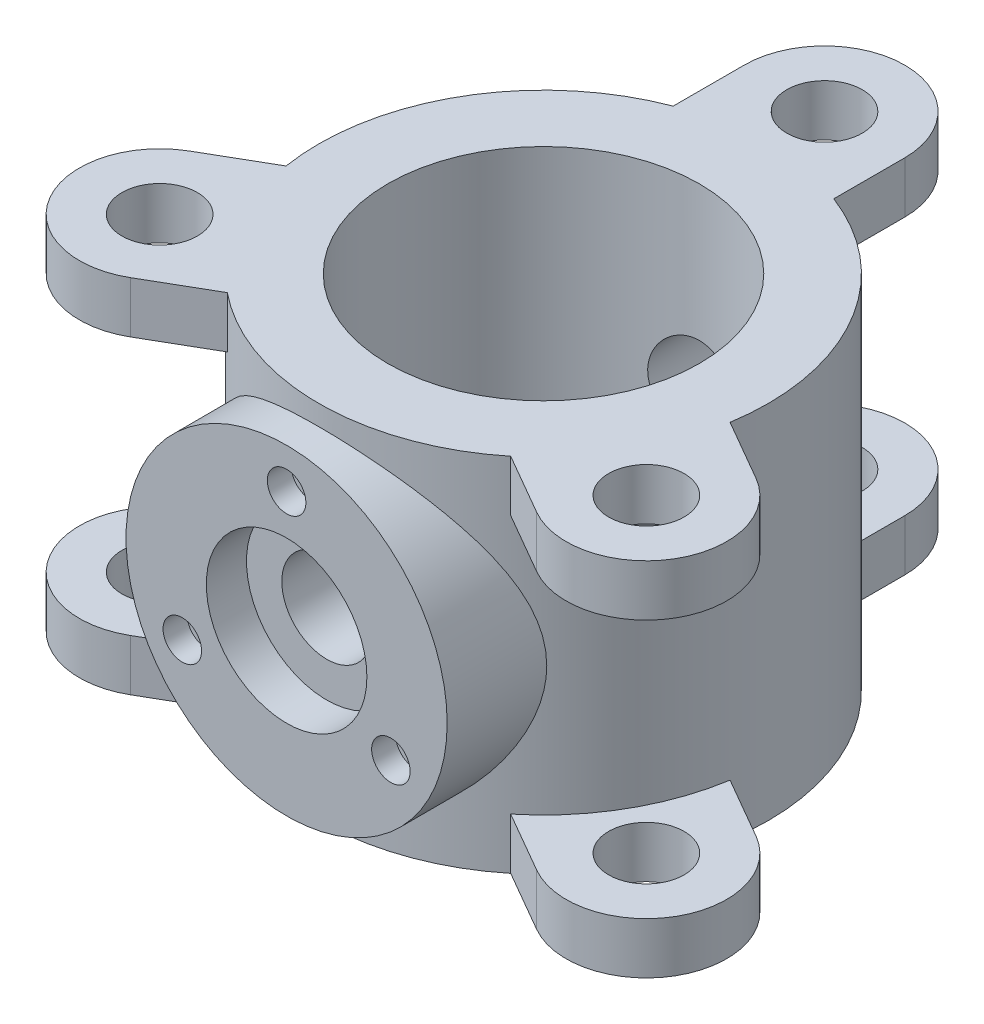
from build123d import *

# Parameters (mm, degrees)
SKETCH1_R                = 140
SKETCH1_R_2              = 97
BOSS_EXTRUDE1_DEPTH      = 225
SKETCH2_R                = 23.5
BOSS_EXTRUDE2_DEPTH      = 32
CIRPATTERN1_COUNT        = 3
MIRROR1_COPY_1_SKETCH_R  = 23.5
MIRROR1_COPY_1_DEPTH     = 32
MIRROR1_COPY_2_SKETCH_R  = 23.5
MIRROR1_COPY_2_DEPTH     = 32
BOSS_EXTRUDE4_REACH      = 491.361
BOSS_EXTRUDE4_END_RADIUS = 140
SKETCH3_R                = 100
SKETCH5_R                = 50
CUT_EXTRUDE1_DEPTH       = 25
SKETCH6_R                = 28
CUT_EXTRUDE2_DEPTH       = 470.945948606
SKETCH7_R                = 12
CUT_EXTRUDE3_DEPTH       = 15
CIRPATTERN2_COUNT        = 3


with BuildPart() as part:
    # Sketch1 → Boss-Extrude1 (new body)
    with BuildSketch(Plane(origin=(0, 0, 0), x_dir=(1, 0, 0), z_dir=(0, 1, 0))):
        with Locations(Location((0, 0, 0), (0, 0, 270))):
            Circle(SKETCH1_R)
        with Locations(Location((0, 0, 0), (0, 0, 270))):
            Circle(SKETCH1_R_2, mode=Mode.SUBTRACT)
    extrude(amount=BOSS_EXTRUDE1_DEPTH)

    # Sketch2 → Boss-Extrude2 (add)
    with BuildSketch(Plane(origin=(0, 225, 0), x_dir=(1, 0, 0), z_dir=(0, 1, 0))):
        with BuildLine():
            Line((-50, 175), (-50, 107.636773109))
            Line((-50, 107.636773109), (50, 107.636773109))
            Line((50, 107.636773109), (50, 175))
            ThreePointArc((50, 175), (0, 225), (-50, 175))
        make_face()
        with Locations(Location((0, 175, 0), (0, 0, 270))):
            Circle(SKETCH2_R, mode=Mode.SUBTRACT)
    boss_extrude2 = extrude(amount=-BOSS_EXTRUDE2_DEPTH)

    # CirPattern1: Boss-Extrude2 ×3 about axis
    cirpattern1_axis = Axis((0, 0, 0), (0, 1, 0))
    for i in range(1, CIRPATTERN1_COUNT):
        add(boss_extrude2.rotate(cirpattern1_axis, i * 360 / CIRPATTERN1_COUNT))

    # Mirror1: Boss-Extrude2 across plane
    add(boss_extrude2.mirror(Plane.ZX.offset(112.5)))

    # Mirror1 copy 1 sketch → Mirror1 copy 1 (add)
    with BuildSketch(Plane(origin=(0, 0, 0), x_dir=(-0.4999999999999998, 0, -0.8660254037844387), z_dir=(0, -1, 0))):
        with BuildLine():
            Line((-50, -175), (-50, -107.636773109))
            Line((-50, -107.636773109), (50, -107.636773109))
            Line((50, -107.636773109), (50, -175))
            ThreePointArc((50, -175), (0, -225), (-50, -175))
        make_face()
        with Locations((0, -175)):
            Circle(MIRROR1_COPY_1_SKETCH_R, mode=Mode.SUBTRACT)
    extrude(amount=-MIRROR1_COPY_1_DEPTH)

    # Mirror1 copy 2 sketch → Mirror1 copy 2 (add)
    with BuildSketch(Plane(origin=(0, 0, 0), x_dir=(-0.5000000000000004, 0, 0.8660254037844384), z_dir=(0, -1, 0))):
        with BuildLine():
            Line((-50, -175), (-50, -107.636773109))
            Line((-50, -107.636773109), (50, -107.636773109))
            Line((50, -107.636773109), (50, -175))
            ThreePointArc((50, -175), (0, -225), (-50, -175))
        make_face()
        with Locations((0, -175)):
            Circle(MIRROR1_COPY_2_SKETCH_R, mode=Mode.SUBTRACT)
    extrude(amount=-MIRROR1_COPY_2_DEPTH)

    # Boss-Extrude4: up to this cylinder (the profile starts outside it)
    boss_extrude4_end = Plane(origin=(0, 112.5, 0), z_dir=(0, -1, 0)) * Cylinder(BOSS_EXTRUDE4_END_RADIUS, 1263.722, mode=Mode.PRIVATE)
    # Sketch3 → Boss-Extrude4 (add, up to the surface)
    with BuildSketch(Plane.XY.offset(160), mode=Mode.PRIVATE) as boss_extrude4_sk1:
        with Locations((0, 112.5)):
            Circle(SKETCH3_R)
    boss_extrude4_tool1 = extrude(boss_extrude4_sk1.sketch, amount=-BOSS_EXTRUDE4_REACH, mode=Mode.PRIVATE) - boss_extrude4_end
    add(boss_extrude4_tool1.solids().sort_by_distance((0, 112.5, 160))[0])

    # Sketch5 → Cut-Extrude1 (cut)
    with BuildSketch(Plane.XY.offset(160)):
        with Locations((0, 112.5)):
            Circle(SKETCH5_R)
    extrude(amount=-CUT_EXTRUDE1_DEPTH, mode=Mode.SUBTRACT)

    # Sketch6 → Cut-Extrude2 (cut, through all)
    with BuildSketch(Plane.XY.offset(135)):
        with Locations((0, 112.5)):
            Circle(SKETCH6_R)
    extrude(amount=-CUT_EXTRUDE2_DEPTH, mode=Mode.SUBTRACT)

    # Sketch7 → Cut-Extrude3 (cut)
    with BuildSketch(Plane.XY.offset(160)):
        with Locations((0, 187.5)):
            Circle(SKETCH7_R)
    cut_extrude3 = extrude(amount=-CUT_EXTRUDE3_DEPTH, mode=Mode.SUBTRACT)

    # CirPattern2: Cut-Extrude3 ×3 about axis
    cirpattern2_axis = Axis((0, 112.5, 0), (0, 0, 1))
    for i in range(1, CIRPATTERN2_COUNT):
        add(cut_extrude3.rotate(cirpattern2_axis, i * 360 / CIRPATTERN2_COUNT), mode=Mode.SUBTRACT)


solid = part.part
